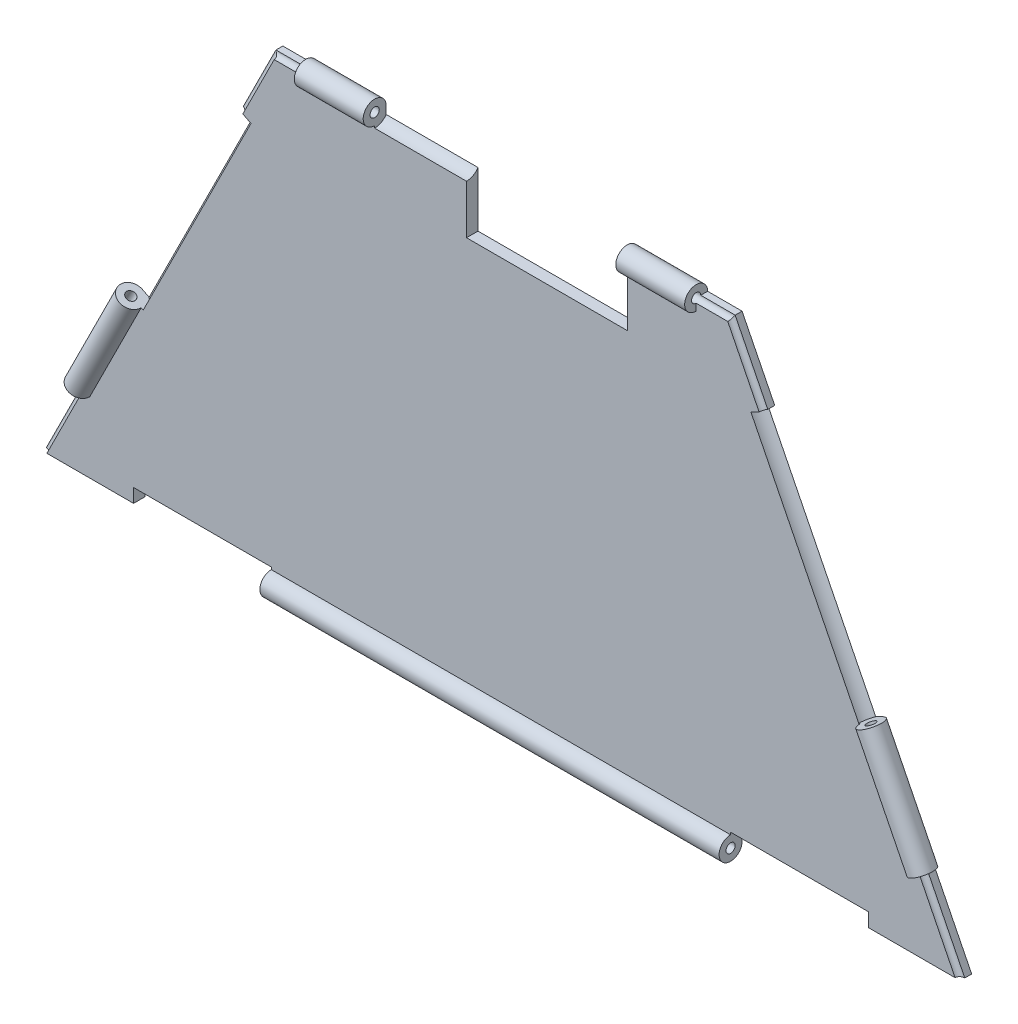
from build123d import *

# Parameters (mm, degrees)
EXTRUDE_1_DEPTH      = 5
SKETCH_9_W           = 30
SKETCH_9_H           = 5
SKETCH_10_R          = 2
CUT_EXTRUDE_3_DEPTH  = 352.212186577
SKETCH_4_W           = 5
SKETCH_4_H           = 50
SKETCH_11_R          = 2
CUT_EXTRUDE_4_DEPTH  = 338.069639722
SKETCH_12_R          = 6
CUT_EXTRUDE_5_DEPTH  = 105
SKETCH_14_R          = 6
CUT_EXTRUDE_6_DEPTH  = 110
SKETCH_3_W           = 200
SKETCH_3_H           = 5
SKETCH_15_R          = 2
CUT_EXTRUDE_7_DEPTH  = 200
SKETCH_16_R          = 6
CUT_EXTRUDE_8_DEPTH  = 60
CUT_EXTRUDE_START    = 60
SKETCH_17_R          = 6
CUT_EXTRUDE_9_DEPTH  = 60
SCALE_1_SCALE        = 0.5
SKETCH_19_W          = 35
SKETCH_19_H          = 12
CUT_EXTRUDE_11_DEPTH = 10


with BuildPart() as part:
    # 草图2 → 凸台-拉伸1 (new body)
    with BuildSketch(Plane(origin=(0, 65.305030884, 0), x_dir=(1, 0, 0), z_dir=(0, 0, 1))):
        Polygon((-200, 0), (-155, 0), (-105, 0), (105, 0), (155, 0), (200, 0), (195.839393539, 8.321212923), (151.118033989, 97.763932023), (100, 200), (50, 200), (-50, 200), (-100, 200), (-151.118033989, 97.763932023), (-195.839393539, 8.321212923), align=None)
    extrude(amount=EXTRUDE_1_DEPTH)

    # 草图9 → 旋转1 (revolve)
    with BuildSketch(Plane(origin=(0, 65.305030884, 5), x_dir=(1, 0, 0), z_dir=(0, 0, 1))):
        with Locations((-70, 197.5)):
            Rectangle(SKETCH_9_W, SKETCH_9_H)
    revolve_1 = revolve(axis=Axis((-85, 265.305030884, 5), (1, 0, 0)))

    # 草图10 → 切除-拉伸3 (cut, symmetric)
    with BuildSketch(Plane(origin=(-85, 65.305030884, 0), x_dir=(0, 0, 1), z_dir=(-1, 0, 0))):
        with Locations(Location((5, 200, 0), (0, 0, 270))):
            Circle(SKETCH_10_R)
    cut_extrude_3 = extrude(amount=CUT_EXTRUDE_3_DEPTH, both=True, mode=Mode.SUBTRACT)

    # 镜向2: 旋转1, 切除-拉伸3 across plane
    add(revolve_1.mirror(Plane(origin=(0, 0, 0), x_dir=(0, 0, 1), z_dir=(1, 0, 0))))
    add(cut_extrude_3.mirror(Plane(origin=(0, 0, 0), x_dir=(0, 0, 1), z_dir=(1, 0, 0))), mode=Mode.SUBTRACT)

    # 草图4 → 旋转2 (revolve)
    with BuildSketch(Plane(origin=(-160, 145.305030884, 0), x_dir=(0, 0, 1), z_dir=(-0.8944271909999162, 0.4472135954999576, 0))):
        with Locations((2.5, -27.639320225)):
            Rectangle(SKETCH_4_W, SKETCH_4_H)
    revolve_2 = revolve(axis=Axis((-161.180339887, 142.944351109, 5), (-0.4472135954999577, -0.894427190999916, 0)))

    # 草图11 → 切除-拉伸4 (cut, symmetric)
    with BuildSketch(Plane(origin=(-23.541019662, 18.222991559, 0), x_dir=(0.8944271909999161, -0.4472135954999577, 0), z_dir=(-0.4472135954999577, -0.8944271909999161, 0))):
        with Locations((-178.8854382, 5)):
            Circle(SKETCH_11_R)
    cut_extrude_4 = extrude(amount=CUT_EXTRUDE_4_DEPTH, both=True, mode=Mode.SUBTRACT)

    # 草图12 → 切除-拉伸5 (cut)
    with BuildSketch(Plane(origin=(-1.180339887, 62.944351109, 0), x_dir=(0.8944271909999161, -0.4472135954999577, 0), z_dir=(0.4472135954999577, 0.8944271909999161, 0))):
        with Locations((-178.8854382, -5)):
            Circle(SKETCH_12_R)
    cut_extrude_5 = extrude(amount=CUT_EXTRUDE_5_DEPTH, mode=Mode.SUBTRACT)

    # 草图14 → 切除-拉伸6 (cut)
    # profile 1 of 2: a face of its own
    with BuildSketch(Plane(origin=(-55, 65.305030884, 0), x_dir=(0, 0, -1), z_dir=(1, 0, 0))):
        with Locations((-5, 200)):
            Circle(SKETCH_14_R)
        with BuildLine():
            Line((-5, 195), (-5, 198))
            ThreePointArc((-5, 198), (-6.414213562, 201.414213562), (-3, 200))
            Line((-3, 200), (0, 200))
            ThreePointArc((0, 200), (-8.535533906, 203.535533906), (-5, 195))
        make_face(mode=Mode.SUBTRACT)
    # profile 2 of 2: a face of its own
    with BuildSketch(Plane(origin=(-55, 65.305030884, 0), x_dir=(0, 0, -1), z_dir=(1, 0, 0))):
        with BuildLine():
            ThreePointArc((0, 200), (-8.535533906, 203.535533906), (-5, 195))
            Line((-5, 195), (-5, 198))
            ThreePointArc((-5, 198), (-6.414213562, 201.414213562), (-3, 200))
            Line((-3, 200), (0, 200))
        make_face()
    extrude(amount=CUT_EXTRUDE_6_DEPTH, mode=Mode.SUBTRACT)

    # 镜向3: 旋转2, 切除-拉伸4, 切除-拉伸5 across plane
    add(revolve_2.mirror(Plane(origin=(0, 0, 0), x_dir=(0, 0, 1), z_dir=(1, 0, 0))))
    add(cut_extrude_4.mirror(Plane(origin=(0, 0, 0), x_dir=(0, 0, 1), z_dir=(1, 0, 0))), mode=Mode.SUBTRACT)
    add(cut_extrude_5.mirror(Plane(origin=(0, 0, 0), x_dir=(0, 0, 1), z_dir=(1, 0, 0))), mode=Mode.SUBTRACT)

    # 草图3 → 旋转3 (revolve)
    with BuildSketch(Plane.XZ.offset(-65.305030884)):
        with Locations((0, 2.5)):
            Rectangle(SKETCH_3_W, SKETCH_3_H)
    revolve(axis=Axis((-100, 65.305030884, 5), (1, 0, 0)))

    # 草图15 → 切除-拉伸7 (cut)
    with BuildSketch(Plane(origin=(100, 65.305030884, 0), x_dir=(0, 0, -1), z_dir=(1, 0, 0))):
        with Locations(Location((-5, 0, 0), (0, 0, 90))):
            Circle(SKETCH_15_R)
    extrude(amount=-CUT_EXTRUDE_7_DEPTH, mode=Mode.SUBTRACT)

    # 草图16 → 切除-拉伸8 (cut)
    with BuildSketch(Plane(origin=(100, 65.305030884, 0), x_dir=(0, 0, -1), z_dir=(1, 0, 0))):
        with Locations((-5, 0)):
            Circle(SKETCH_16_R)
    extrude(amount=CUT_EXTRUDE_8_DEPTH, mode=Mode.SUBTRACT)

    # 草图17 → 切除-拉伸9 (cut)
    with BuildSketch(Plane(origin=(-100, 65.305030884, 0), x_dir=(0, 0, 1), z_dir=(-1, 0, 0)).offset(CUT_EXTRUDE_START)):
        with Locations((5, 0)):
            Circle(SKETCH_17_R)
    extrude(amount=-CUT_EXTRUDE_9_DEPTH, mode=Mode.SUBTRACT)


with BuildPart() as part_1:
    # 缩放比例1: scaled about (0, 0, 0)
    add(part.part.scale(SCALE_1_SCALE))

    # 草图19 → 切除-拉伸11 (cut)
    with BuildSketch(Plane(origin=(0, 0, 0), x_dir=(-1, 0, 0), z_dir=(0, 0, -1))):
        with Locations((-10, 124.994203047)):
            Rectangle(SKETCH_19_W, SKETCH_19_H)
    extrude(amount=-CUT_EXTRUDE_11_DEPTH, mode=Mode.SUBTRACT)


solid = part_1.part
